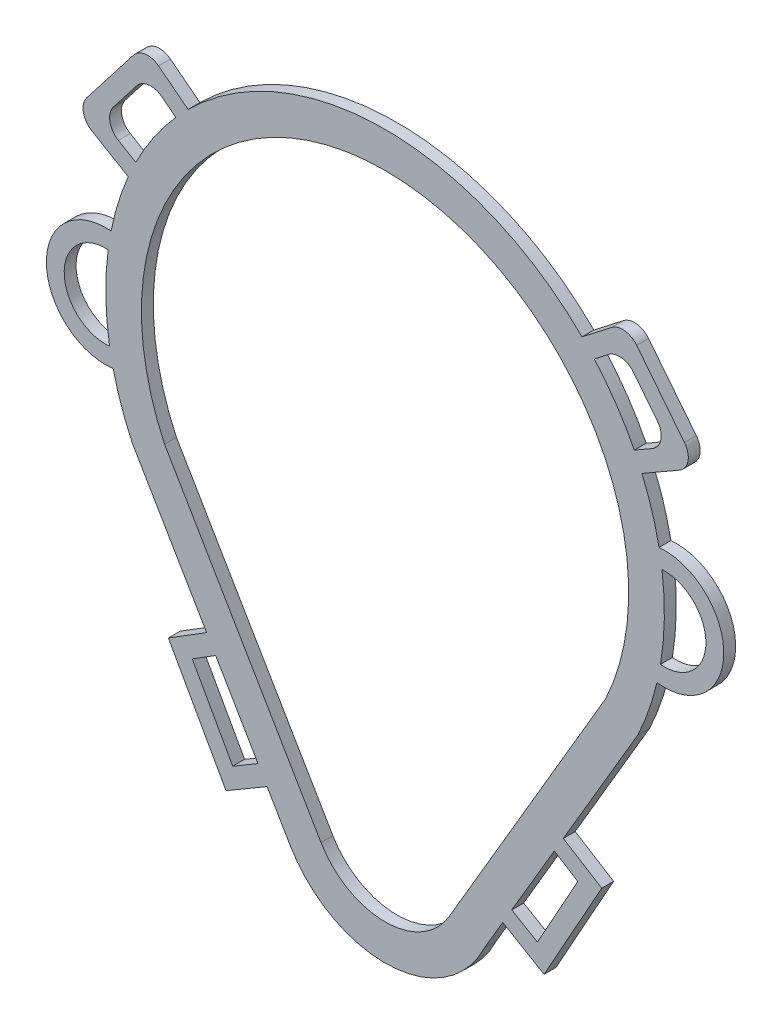
from build123d import *

# Parameters (mm, degrees)
BOSS_EXTRUDE1_DEPTH = 2
BOSS_EXTRUDE2_DEPTH = 2
BOSS_EXTRUDE3_DEPTH = 2
BOSS_EXTRUDE4_DEPTH = 2


with BuildPart() as part:
    # Sketch1 → Boss-Extrude1 (new body)
    with BuildSketch(Plane.XY):
        with BuildLine():
            Line((-42.535849019, -19.992537313), (-15.962294716, -65.351510343))
            ThreePointArc((-15.962294716, -65.351510343), (0.796651985, -74.482720143), (16.707746892, -63.94334892))
            Line((16.707746892, -63.94334892), (42.535849019, -19.992537313))
            ThreePointArc((42.535849019, -19.992537313), (0, 47), (-42.535849019, -19.992537313))
        make_face()
        with BuildLine():
            Line((-37.105740634, -17.440298507), (-10.782429992, -62.323701721))
            ThreePointArc((-10.782429992, -62.323701721), (0, -68.5), (10.782429992, -62.323701721))
            Line((10.782429992, -62.323701721), (37.105740634, -17.440298507))
            ThreePointArc((37.105740634, -17.440298507), (0, 41), (-37.105740634, -17.440298507))
        make_face(mode=Mode.SUBTRACT)
    extrude(amount=BOSS_EXTRUDE1_DEPTH)

    # Sketch2 → Boss-Extrude2 (add)
    # profile 1 of 2: a face of its own
    with BuildSketch(Plane.XY.offset(2)):
        Polygon((26.759176347, -62.767156645), (36.457259187, -45.358054665), (27.445544724, -39.749965749), (17.215221157, -57.158562848), align=None)
        Polygon((28.472990289, -43.922830436), (21.321628044, -56.09206274), (25.632383873, -58.62531839), (32.445531084, -46.394986216), align=None, mode=Mode.SUBTRACT)
    # profile 2 of 2: a face of its own
    with BuildSketch(Plane.XY.offset(2)):
        Polygon((-17.215221157, -57.158562848), (-26.759176347, -62.767156645), (-36.457259187, -45.358054665), (-27.445544724, -39.749965749), align=None)
        Polygon((-32.445531084, -46.394986216), (-28.472990289, -43.922830436), (-21.321628044, -56.09206274), (-25.632383873, -58.62531839), align=None, mode=Mode.SUBTRACT)
    extrude(amount=-BOSS_EXTRUDE2_DEPTH)

    # Sketch3 → Boss-Extrude3 (add)
    # profile 1 of 2: a face of its own
    with BuildSketch(Plane.XY.offset(2)):
        with BuildLine():
            Line((-31.151373165, 31.772817784), (-38.114457897, 37.177116489))
            ThreePointArc((-38.114457897, 37.177116489), (-40.329006137, 37.783626199), (-42.323795344, 36.64657125))
            Line((-42.323795344, 36.64657125), (-50.184128352, 26.519047267))
            ThreePointArc((-50.184128352, 26.519047267), (-50.760622602, 24.115277799), (-49.336666072, 22.094683561))
            Line((-49.336666072, 22.094683561), (-41.03528616, 17.205385487))
            Line((-41.03528616, 17.205385487), (-31.151373165, 31.772817784))
        make_face()
        with BuildLine():
            Line((-35.213971315, 31.128382936), (-37.583912658, 32.967779041))
            ThreePointArc((-37.583912658, 32.967779041), (-39.798460899, 33.574288752), (-41.793250106, 32.437233803))
            Line((-41.793250106, 32.437233803), (-45.72341661, 27.373471811))
            ThreePointArc((-45.72341661, 27.373471811), (-46.29991086, 24.969702343), (-44.87595433, 22.949108105))
            Line((-44.87595433, 22.949108105), (-41.937721652, 21.218565047))
            Line((-41.937721652, 21.218565047), (-35.213971315, 31.128382936))
        make_face(mode=Mode.SUBTRACT)
    # profile 2 of 2: a face of its own
    with BuildSketch(Plane.XY.offset(2)):
        with BuildLine():
            Line((31.151373165, 31.772817784), (41.03528616, 17.205385487))
            Line((41.03528616, 17.205385487), (49.521231884, 22.082259987))
            ThreePointArc((49.521231884, 22.082259987), (50.972840228, 24.118942465), (50.376596508, 26.547879626))
            Line((50.376596508, 26.547879626), (42.329184832, 36.691250185))
            ThreePointArc((42.329184832, 36.691250185), (40.338269585, 37.80509541), (38.139596853, 37.19662773))
            Line((38.139596853, 37.19662773), (31.151373165, 31.772817784))
        make_face()
        with BuildLine():
            Line((35.213971315, 31.128382936), (41.937721652, 21.218565047))
            Line((41.937721652, 21.218565047), (44.9588763, 22.954823155))
            ThreePointArc((44.9588763, 22.954823155), (46.410484644, 24.991505634), (45.814240924, 27.420442794))
            Line((45.814240924, 27.420442794), (41.798639593, 32.481912737))
            ThreePointArc((41.798639593, 32.481912737), (39.807724347, 33.595757962), (37.609051614, 32.987290283))
            Line((37.609051614, 32.987290283), (35.213971315, 31.128382936))
        make_face(mode=Mode.SUBTRACT)
    extrude(amount=-BOSS_EXTRUDE3_DEPTH)

    # Sketch4 → Boss-Extrude4 (add)
    # profile 1 of 2: a face of its own
    with BuildSketch(Plane.XY.offset(2)):
        with BuildLine():
            Line((42.848392472, 8.262286082), (42.848392472, -9.939496711))
            ThreePointArc((42.848392472, -9.939496711), (56.992517927, -0.838605315), (42.848392472, 8.262286082))
        make_face()
        with BuildLine():
            Line((45.848392472, 6.067260087), (45.848392472, -7.744470716))
            ThreePointArc((45.848392472, -7.744470716), (53.992517927, -0.838605315), (45.848392472, 6.067260087))
        make_face(mode=Mode.SUBTRACT)
    # profile 2 of 2: a face of its own
    with BuildSketch(Plane.XY.offset(2)):
        with BuildLine():
            Line((-42.848392472, 8.262286082), (-42.848392472, -9.939496711))
            ThreePointArc((-42.848392472, -9.939496711), (-56.992517927, -0.838605315), (-42.848392472, 8.262286082))
        make_face()
        with BuildLine():
            Line((-45.848392472, 6.067260087), (-45.848392472, -7.744470716))
            ThreePointArc((-45.848392472, -7.744470716), (-53.992517927, -0.838605315), (-45.848392472, 6.067260087))
        make_face(mode=Mode.SUBTRACT)
    extrude(amount=-BOSS_EXTRUDE4_DEPTH)


solid = part.part
